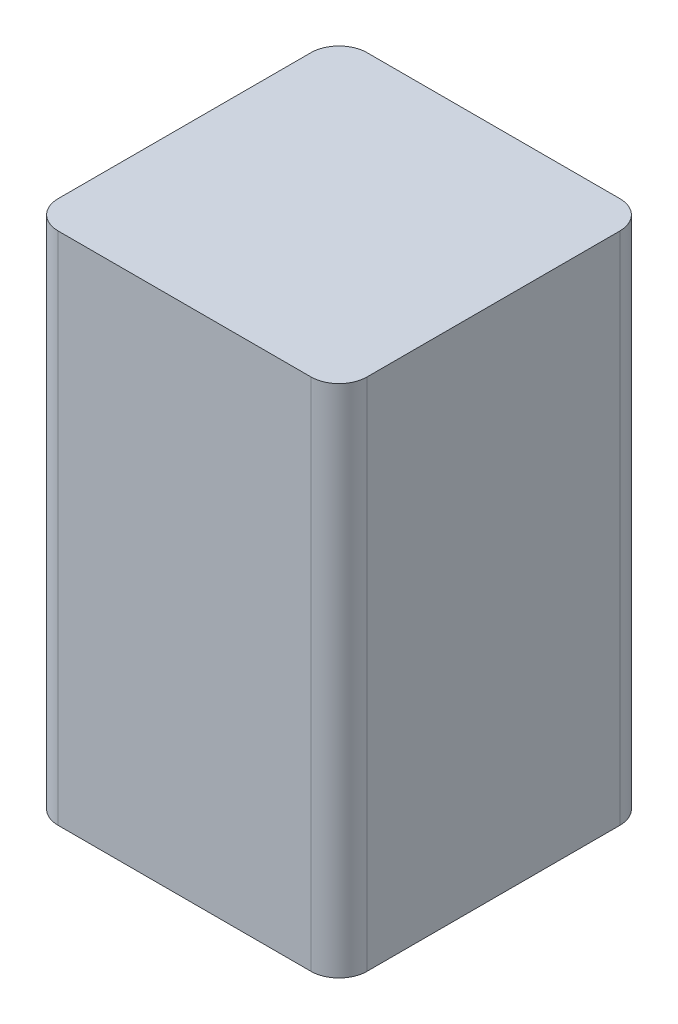
from build123d import *

# Parameters (mm, degrees)
SKETCH_1_W      = 33
SKETCH_1_H      = 33
EXTRUDE_1_DEPTH = 55
FILLET_1_R      = 3


with BuildPart() as part:
    # 草图1 → 凸台-拉伸1 (new body)
    with BuildSketch(Plane(origin=(0, 0, 0), x_dir=(1, 0, 0), z_dir=(0, 1, 0))):
        Rectangle(SKETCH_1_W, SKETCH_1_H)
    extrude(amount=EXTRUDE_1_DEPTH)

    # 圆角1
    fillet_1_edges = [part.edges().sort_by_distance(p)[0] for p in [
        (16.5, 27.5, 16.5),
        (-16.5, 27.5, 16.5),
        (-16.5, 27.5, -16.5),
        (16.5, 27.5, -16.5),
    ]]
    fillet(fillet_1_edges, radius=FILLET_1_R)


solid = part.part
